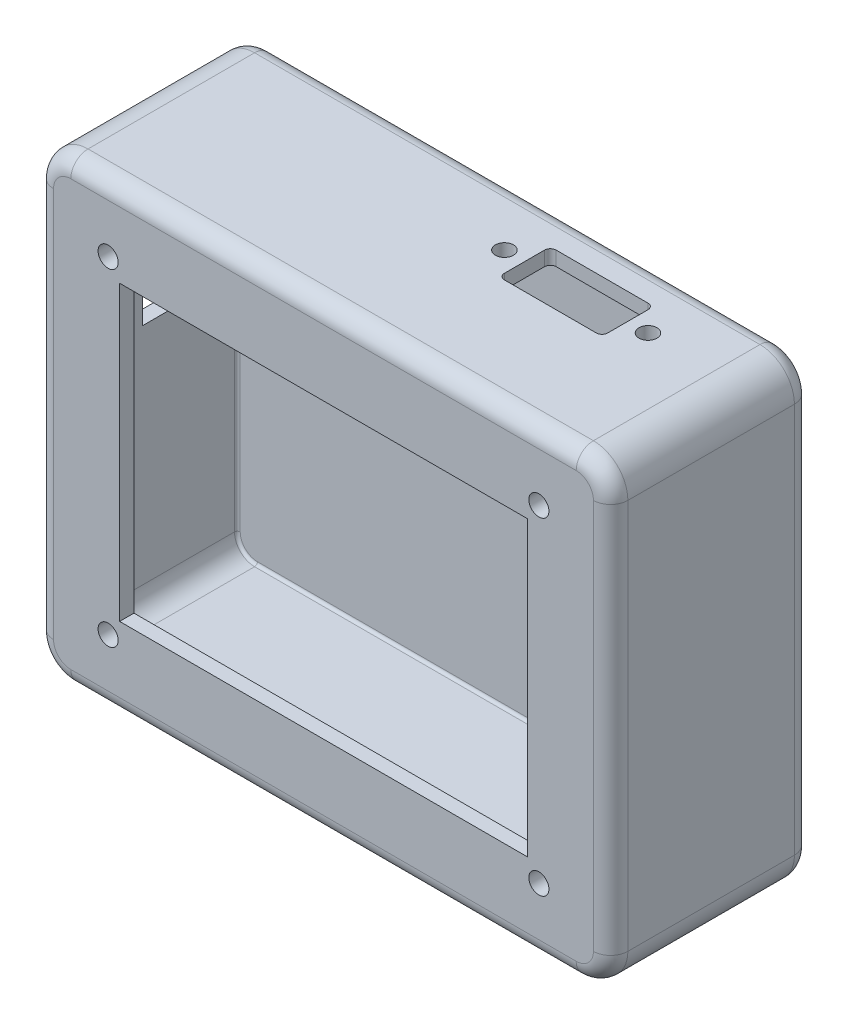
from build123d import *

# Parameters (mm, degrees)
SKETCH1_W           = 100
SKETCH1_H           = 80
BOSS_EXTRUDE1_DEPTH = 17.5
FILLET1_R           = 6
FILLET2_R           = 3
SHELL1_T            = 2.5
CUT_EXTRUDE1_REACH  = 74.973
SKETCH2_R           = 1.75
SKETCH2_W           = 71
SKETCH2_H           = 51
CUT_EXTRUDE2_REACH  = 97.949
SKETCH4_R           = 1.575
SKETCH4_W           = 18
SKETCH4_H           = 9
FILLET4_R           = 1
CUT_EXTRUDE3_REACH  = 111.116
SKETCH5_W           = 13
SKETCH5_H           = 19.8


with BuildPart() as part:
    # Sketch1 → Boss-Extrude1 (new, symmetric)
    with BuildSketch(Plane.XY):
        Rectangle(SKETCH1_W, SKETCH1_H)
    extrude(amount=BOSS_EXTRUDE1_DEPTH, both=True)

    # Fillet1
    fillet1_edges = [part.edges().sort_by_distance(p)[0] for p in [
        (-50, 40, 0),
        (-50, -40, 0),
        (50, -40, 0),
        (50, 40, 0),
    ]]
    fillet(fillet1_edges, radius=FILLET1_R)

    # Fillet2
    fillet2_edges = [part.edges().sort_by_distance(p)[0] for p in [
        (48.242640687, -38.242640687, 17.5),
        (0, -40, 17.5),
        (-48.242640687, -38.242640687, 17.5),
        (-50, 0, 17.5),
        (-48.242640687, 38.242640687, 17.5),
        (0, 40, 17.5),
        (48.242640687, 38.242640687, 17.5),
        (48.242640687, 38.242640687, -17.5),
        (50, 0, -17.5),
        (48.242640687, -38.242640687, -17.5),
        (0, -40, -17.5),
        (-48.242640687, -38.242640687, -17.5),
        (-50, 0, -17.5),
        (-48.242640687, 38.242640687, -17.5),
        (50, 0, 17.5),
        (0, 40, -17.5),
    ]]
    fillet(fillet2_edges, radius=FILLET2_R)

    # Shell1 (no face opened: a closed hollow body)
    add(offset(amount=-SHELL1_T, mode=Mode.PRIVATE), mode=Mode.SUBTRACT)

    # Sketch2 → Cut-Extrude1 (cut, up to next)
    with BuildSketch(Plane.XY.offset(17.5), mode=Mode.PRIVATE) as cut_extrude1_sk1:
        with Locations((37.5, -28.5)):
            Circle(SKETCH2_R)
    cut_extrude1_tool1 = extrude(cut_extrude1_sk1.sketch, amount=-CUT_EXTRUDE1_REACH, mode=Mode.PRIVATE) & part.part
    # Sketch2 → Cut-Extrude1 (cut, up to next)
    with BuildSketch(Plane.XY.offset(17.5), mode=Mode.PRIVATE) as cut_extrude1_sk2:
        with Locations((-37.5, -28.5)):
            Circle(SKETCH2_R)
    cut_extrude1_tool2 = extrude(cut_extrude1_sk2.sketch, amount=-CUT_EXTRUDE1_REACH, mode=Mode.PRIVATE) & part.part
    # Sketch2 → Cut-Extrude1 (cut, up to next)
    with BuildSketch(Plane.XY.offset(17.5), mode=Mode.PRIVATE) as cut_extrude1_sk3:
        with Locations((-37.5, 28.5)):
            Circle(SKETCH2_R)
    cut_extrude1_tool3 = extrude(cut_extrude1_sk3.sketch, amount=-CUT_EXTRUDE1_REACH, mode=Mode.PRIVATE) & part.part
    # Sketch2 → Cut-Extrude1 (cut, up to next)
    with BuildSketch(Plane.XY.offset(17.5), mode=Mode.PRIVATE) as cut_extrude1_sk4:
        with Locations((37.5, 28.5)):
            Circle(SKETCH2_R)
    cut_extrude1_tool4 = extrude(cut_extrude1_sk4.sketch, amount=-CUT_EXTRUDE1_REACH, mode=Mode.PRIVATE) & part.part
    # Sketch2 → Cut-Extrude1 (cut, up to next)
    with BuildSketch(Plane.XY.offset(17.5), mode=Mode.PRIVATE) as cut_extrude1_sk5:
        Rectangle(SKETCH2_W, SKETCH2_H)
    cut_extrude1_tool5 = extrude(cut_extrude1_sk5.sketch, amount=-CUT_EXTRUDE1_REACH, mode=Mode.PRIVATE) & part.part
    add(cut_extrude1_tool1.solids().sort_by_distance((37.5, -28.5, 17.5))[0], mode=Mode.SUBTRACT)
    add(cut_extrude1_tool2.solids().sort_by_distance((-37.5, -28.5, 17.5))[0], mode=Mode.SUBTRACT)
    add(cut_extrude1_tool3.solids().sort_by_distance((-37.5, 28.5, 17.5))[0], mode=Mode.SUBTRACT)
    add(cut_extrude1_tool4.solids().sort_by_distance((37.5, 28.5, 17.5))[0], mode=Mode.SUBTRACT)
    add(cut_extrude1_tool5.solids().sort_by_distance((0, 0, 17.5))[0], mode=Mode.SUBTRACT)

    # Sketch4 → Cut-Extrude2 (cut, up to next)
    with BuildSketch(Plane(origin=(0, 40, 0), x_dir=(1, 0, 0), z_dir=(0, 1, 0)), mode=Mode.PRIVATE) as cut_extrude2_sk1:
        with Locations((32.5, 6.5)):
            Circle(SKETCH4_R)
    cut_extrude2_tool1 = extrude(cut_extrude2_sk1.sketch, amount=-CUT_EXTRUDE2_REACH, mode=Mode.PRIVATE) & part.part
    # Sketch4 → Cut-Extrude2 (cut, up to next)
    with BuildSketch(Plane(origin=(0, 40, 0), x_dir=(1, 0, 0), z_dir=(0, 1, 0)), mode=Mode.PRIVATE) as cut_extrude2_sk2:
        with Locations((7.5, 6.5)):
            Circle(SKETCH4_R)
    cut_extrude2_tool2 = extrude(cut_extrude2_sk2.sketch, amount=-CUT_EXTRUDE2_REACH, mode=Mode.PRIVATE) & part.part
    # Sketch4 → Cut-Extrude2 (cut, up to next)
    with BuildSketch(Plane(origin=(0, 40, 0), x_dir=(1, 0, 0), z_dir=(0, 1, 0)), mode=Mode.PRIVATE) as cut_extrude2_sk3:
        with Locations((20, 6.5)):
            Rectangle(SKETCH4_W, SKETCH4_H)
    cut_extrude2_tool3 = extrude(cut_extrude2_sk3.sketch, amount=-CUT_EXTRUDE2_REACH, mode=Mode.PRIVATE) & part.part
    add(cut_extrude2_tool1.solids().sort_by_distance((32.5, 40, -6.5))[0], mode=Mode.SUBTRACT)
    add(cut_extrude2_tool2.solids().sort_by_distance((7.5, 40, -6.5))[0], mode=Mode.SUBTRACT)
    add(cut_extrude2_tool3.solids().sort_by_distance((20, 40, -6.5))[0], mode=Mode.SUBTRACT)

    # Fillet4
    fillet4_edges = [part.edges().sort_by_distance(p)[0] for p in [
        (11, 38.75, -11),
        (11, 38.75, -2),
        (29, 38.75, -2),
        (29, 38.75, -11),
    ]]
    fillet(fillet4_edges, radius=FILLET4_R)

    # Sketch5 → Cut-Extrude3 (cut, up to next)
    with BuildSketch(Plane.ZY.offset(50), mode=Mode.PRIVATE) as cut_extrude3_sk1:
        with Locations((-5, 15)):
            Rectangle(SKETCH5_W, SKETCH5_H)
    cut_extrude3_tool1 = extrude(cut_extrude3_sk1.sketch, amount=-CUT_EXTRUDE3_REACH, mode=Mode.PRIVATE) & part.part
    add(cut_extrude3_tool1.solids().sort_by_distance((-50, 15, -5))[0], mode=Mode.SUBTRACT)


solid = part.part
